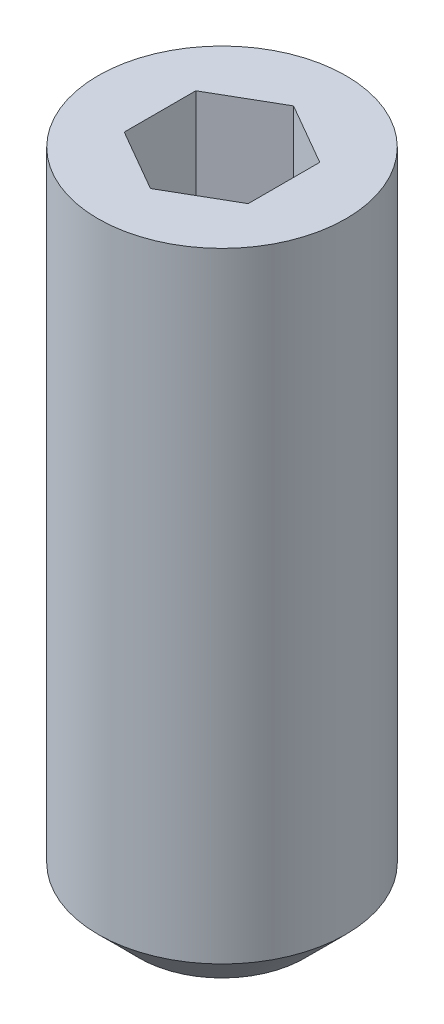
from build123d import *

# Parameters (mm, degrees)
SKETCH1_W          = 1.5
SKETCH1_H          = 8
CUT_EXTRUDE1_DEPTH = 2


with BuildPart() as part:
    # Sketch1 → Revolve1 (revolve)
    with BuildSketch(Plane.XY, mode=Mode.PRIVATE) as revolve1_sk:
        with Locations((0.75, -4)):
            Rectangle(SKETCH1_W, SKETCH1_H)
    revolve(revolve1_sk.sketch.rotate(Axis((0, 0, 0), (0, -1, 0)), 180), axis=Axis((0, 0, 0), (0, -1, 0)))

    # Sketch2 → Cut-Revolve1 (revolve, cut)
    with BuildSketch(Plane.XY, mode=Mode.PRIVATE) as cut_revolve1_sk:
        Polygon((0, 0), (0.75, 0), (0.75, -1.2), (0, -1.633012702), align=None)
    revolve(cut_revolve1_sk.sketch.rotate(Axis((0, 0, 0), (0, -1, 0)), 180), axis=Axis((0, 0, 0), (0, -1, 0)), mode=Mode.SUBTRACT)

    # Sketch3 → Cut-Extrude1 (cut)
    with BuildSketch(Plane(origin=(0, 0, 0), x_dir=(1, 0, 0), z_dir=(0, 1, 0))):
        Polygon((0, 0.866025404), (-0.75, 0.433012702), (-0.75, -0.433012702), (0, -0.866025404), (0.75, -0.433012702), (0.75, 0.433012702), align=None)
    extrude(amount=-CUT_EXTRUDE1_DEPTH, mode=Mode.SUBTRACT)

    # Sketch4 → Cut-Revolve2 (revolve, cut)
    with BuildSketch(Plane.XY, mode=Mode.PRIVATE) as cut_revolve2_sk:
        Polygon((1.5, -7.5), (1.5, -8), (1, -8), align=None)
    revolve(cut_revolve2_sk.sketch.rotate(Axis((0, 0, 0), (0, -1, 0)), 180), axis=Axis((0, 0, 0), (0, -1, 0)), mode=Mode.SUBTRACT)


solid = part.part
